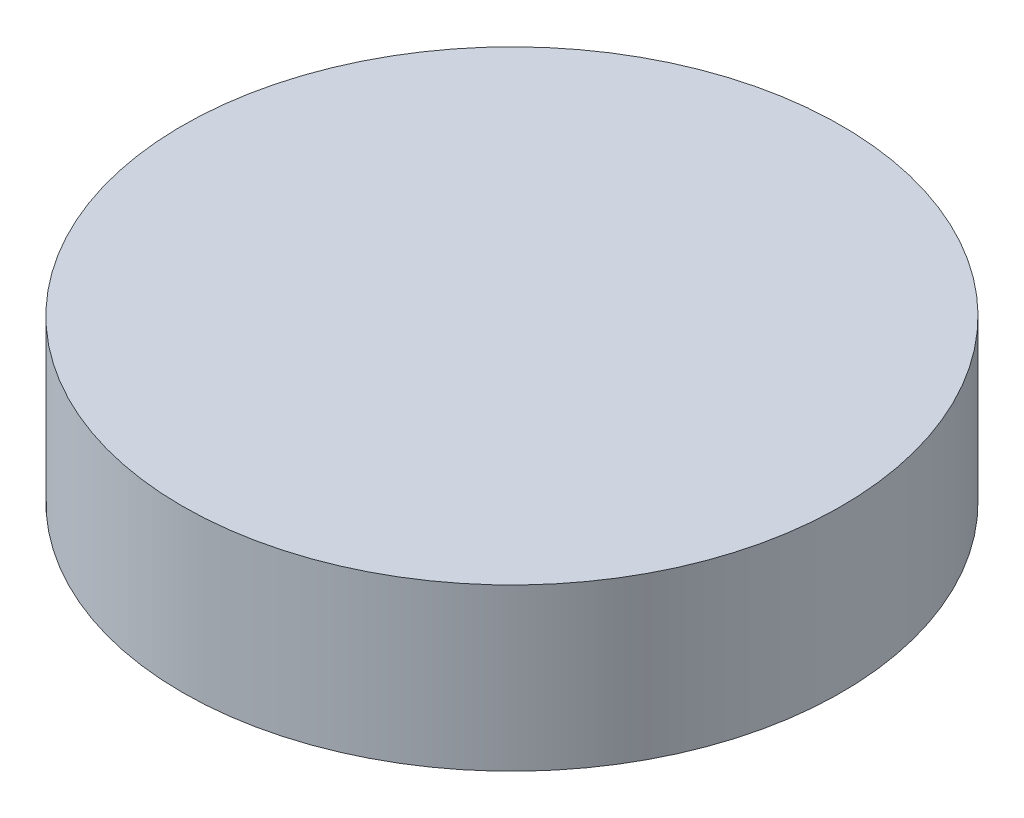
from build123d import *

# Parameters (mm, degrees)
SKETCH1_R           = 38
BOSS_EXTRUDE1_DEPTH = 18.6


with BuildPart() as part:
    # Sketch1 → Boss-Extrude1 (new body)
    with BuildSketch(Plane(origin=(0, 0, 0), x_dir=(1, 0, 0), z_dir=(0, 1, 0))):
        with Locations(Location((0, 0, 0), (0, 0, 270))):
            Circle(SKETCH1_R)
    extrude(amount=BOSS_EXTRUDE1_DEPTH)


solid = part.part
